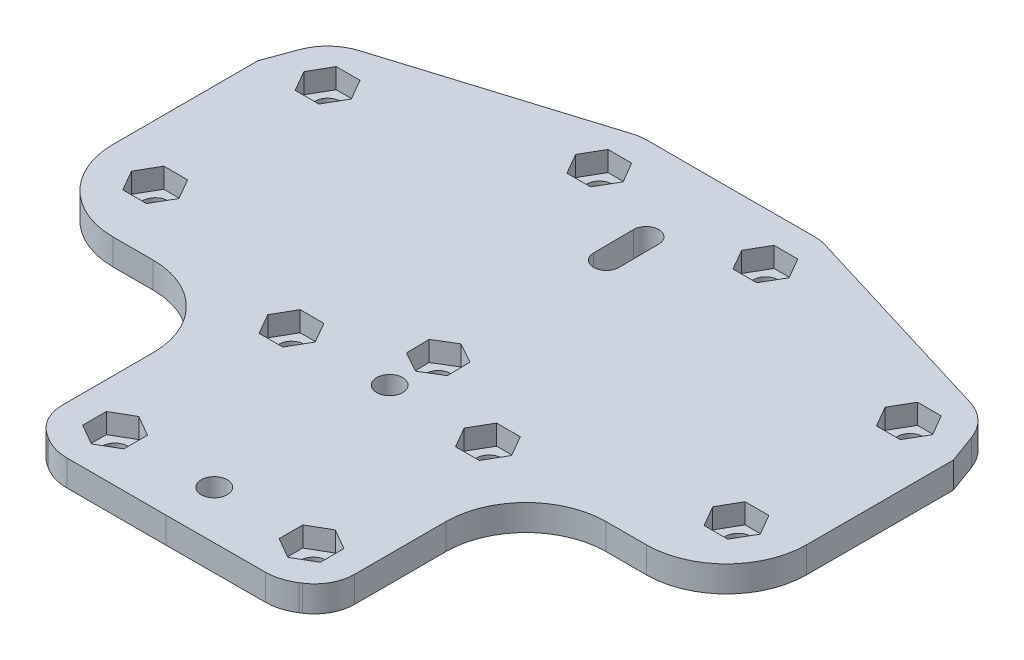
from build123d import *

# Parameters (mm, degrees)
SKETCH2_R          = 3.15
SKETCH2_R_2        = 3.25
SKETCH2_R_3        = 3.1
MAINPLATE_DEPTH    = 6.5
PRESSFITNUTS_DEPTH = 5
CUT_EXTRUDE2_DEPTH = 6.5
FILLET2_R          = 10


with BuildPart() as part:
    # Sketch2 → MainPlate (new body)
    with BuildSketch(Plane(origin=(0, 0, 0), x_dir=(1, 0, 0), z_dir=(0, 1, 0))):
        with BuildLine():
            Line((24.899900609, -92.429929219), (0.2, -92.5))
            Line((0.2, -92.5), (-24.5, -92.5))
            ThreePointArc((-24.5, -92.5), (-27.871368271, -92.016678166), (-30.971160559, -90.605645997))
            Line((-30.971160559, -90.605645997), (-99.683475736, -46.605645997))
            ThreePointArc((-99.683475736, -46.605645997), (-104.578950448, -40.347025165), (-104.490786491, -32.401697323))
            Line((-104.490786491, -32.401697323), (-83.778471314, 24.598302677))
            ThreePointArc((-83.778471314, 24.598302677), (-80.773721892, 29.191692934), (-76.037940173, 31.966602781))
            Line((-76.037940173, 31.966602781), (-24.911380811, 47.741345462))
            ThreePointArc((-24.911380811, 47.741345462), (-22.845839779, 48.308813352), (-20.712315177, 48.5))
            Line((-20.712315177, 48.5), (0, 48.5))
            Line((0, 48.5), (20.712231832, 48.558758223))
            ThreePointArc((20.712231832, 48.558758223), (22.846290221, 48.373624884), (24.913432777, 47.812018957))
            Line((24.913432777, 47.812018957), (76.084537362, 32.182379345))
            ThreePointArc((76.084537362, 32.182379345), (80.828172093, 29.420915478), (83.845940292, 24.836067799))
            Line((83.845940292, 24.836067799), (104.719873926, -32.104944614))
            ThreePointArc((104.719873926, -32.104944614), (104.830577421, -40.049990373), (99.952877324, -46.322473865))
            Line((99.952877324, -46.322473865), (31.365661085, -90.517224974))
            ThreePointArc((31.365661085, -90.517224974), (28.26988419, -91.937045184), (24.899900609, -92.429929219))
        make_face()
        with Locations(Location((-72.5, 20.5, 0), (0, 0, 90))):
            Circle(SKETCH2_R, mode=Mode.SUBTRACT)
        with Locations(Location((-20.712315177, 36.5, 0), (0, 0, 90))):
            Circle(SKETCH2_R, mode=Mode.SUBTRACT)
        with Locations(Location((-93.212315177, -36.5, 0), (0, 0, 90))):
            Circle(SKETCH2_R, mode=Mode.SUBTRACT)
        with Locations(Location((-58.856157589, -58.5, 0), (0, 0, 90))):
            Circle(SKETCH2_R, mode=Mode.SUBTRACT)
        with Locations(Location((-24.5, -80.5, 0), (0, 0, 90))):
            Circle(SKETCH2_R, mode=Mode.SUBTRACT)
        with Locations(Location((-24.5, -36.5, 0), (0, 0, 90))):
            Circle(SKETCH2_R, mode=Mode.SUBTRACT)
        with Locations(Location((-72.5, -22.5, 0), (0, 0, 90))):
            Circle(SKETCH2_R, mode=Mode.SUBTRACT)
        with Locations(Location((24.74103568, -36.430154559, 0), (0, 0, 90))):
            Circle(SKETCH2_R, mode=Mode.SUBTRACT)
        with Locations(Location((24.865858124, -80.429977506, 0), (0, 0, 90))):
            Circle(SKETCH2_R, mode=Mode.SUBTRACT)
        with Locations(Location((59.159466244, -58.332601952, 0), (0, 0, 90))):
            Circle(SKETCH2_R, mode=Mode.SUBTRACT)
        with Locations(Location((93.453074364, -36.235226398, 0), (0, 0, 90))):
            Circle(SKETCH2_R, mode=Mode.SUBTRACT)
        with Locations(Location((72.701126299, -22.294040956, 0), (0, 0, 90))):
            Circle(SKETCH2_R, mode=Mode.SUBTRACT)
        with Locations(Location((72.579140729, 20.705786015, 0), (0, 0, 90))):
            Circle(SKETCH2_R, mode=Mode.SUBTRACT)
        with Locations(Location((20.746274317, 36.55880651, 0), (0, 0, 90))):
            Circle(SKETCH2_R, mode=Mode.SUBTRACT)
        with Locations(Location((0, -36.5, 0), (0, 0, 90))):
            Circle(SKETCH2_R_2, mode=Mode.SUBTRACT)
        with Locations(Location((0.182929062, -80.464988753, 0), (0, 0, 90))):
            Circle(SKETCH2_R_2, mode=Mode.SUBTRACT)
        with Locations(Location((0.103546099, -24.5, 0), (0, 0, 90))):
            Circle(SKETCH2_R_3, mode=Mode.SUBTRACT)
        with BuildLine():
            Line((3.105906565, 27.527701056), (3.193849827, 17.527701056))
            ThreePointArc((3.193849827, 17.527701056), (0.071672688, 14.350121804), (-3.105906565, 17.472298944))
            Line((-3.105906565, 17.472298944), (-3.193849827, 27.472298944))
            ThreePointArc((-3.193849827, 27.472298944), (-0.071672688, 30.649878196), (3.105906565, 27.527701056))
        make_face(mode=Mode.SUBTRACT)
    extrude(amount=MAINPLATE_DEPTH)

    # Sketch8 → PressFitNuts (cut)
    with BuildSketch(Plane(origin=(0, 6.5, 0), x_dir=(1, 0, 0), z_dir=(0, 1, 0))):
        Polygon((-4.835460238, -27.48990798), (0.223379197, -30.272258948), (5.162385534, -27.282350968), (5.042552437, -21.51009202), (-0.016286998, -18.727741052), (-4.955293335, -21.717649032), align=None)
        Polygon((-18.582159741, -36.5), (-21.54107987, -31.375), (-27.45892013, -31.375), (-30.417840259, -36.5), (-27.45892013, -41.625), (-21.54107987, -41.625), align=None)
        Polygon((-66.582159741, -22.5), (-69.54107987, -17.375), (-75.45892013, -17.375), (-78.417840259, -22.5), (-75.45892013, -27.625), (-69.54107987, -27.625), align=None)
        Polygon((-66.582159741, 20.5), (-69.54107987, 25.625), (-75.45892013, 25.625), (-78.417840259, 20.5), (-75.45892013, 15.375), (-69.54107987, 15.375), align=None)
        Polygon((-87.294474918, -36.5), (-90.253395048, -31.375), (-96.171235307, -31.375), (-99.130155436, -36.5), (-96.171235307, -41.625), (-90.253395048, -41.625), align=None)
        Polygon((-52.938317329, -58.5), (-55.897237459, -53.375), (-61.815077718, -53.375), (-64.773997848, -58.5), (-61.815077718, -63.625), (-55.897237459, -63.625), align=None)
        Polygon((-24.5, -74.582159741), (-29.625, -77.54107987), (-29.625, -83.45892013), (-24.5, -86.417840259), (-19.375, -83.45892013), (-19.375, -77.54107987), align=None)
        Polygon((-14.794474918, 36.5), (-17.753395048, 41.625), (-23.671235307, 41.625), (-26.630155436, 36.5), (-23.671235307, 31.375), (-17.753395048, 31.375), align=None)
        Polygon((17.753395048, 31.375), (14.794474918, 36.5), (17.753395048, 41.625), (23.671235307, 41.625), (26.630155436, 36.5), (23.671235307, 31.375), align=None)
        Polygon((19.375, -77.54107987), (24.5, -74.582159741), (29.625, -77.54107987), (29.625, -83.45892013), (24.5, -86.417840259), (19.375, -83.45892013), align=None)
        Polygon((55.897237459, -63.625), (52.938317329, -58.5), (55.897237459, -53.375), (61.815077718, -53.375), (64.773997848, -58.5), (61.815077718, -63.625), align=None)
        Polygon((90.253395048, -41.625), (87.294474918, -36.5), (90.253395048, -31.375), (96.171235307, -31.375), (99.130155436, -36.5), (96.171235307, -41.625), align=None)
        Polygon((69.54107987, 15.375), (66.582159741, 20.5), (69.54107987, 25.625), (75.45892013, 25.625), (78.417840259, 20.5), (75.45892013, 15.375), align=None)
        Polygon((69.54107987, -27.625), (66.582159741, -22.5), (69.54107987, -17.375), (75.45892013, -17.375), (78.417840259, -22.5), (75.45892013, -27.625), align=None)
        Polygon((21.54107987, -41.625), (18.582159741, -36.5), (21.54107987, -31.375), (27.45892013, -31.375), (30.417840259, -36.5), (27.45892013, -41.625), align=None)
    extrude(amount=-PRESSFITNUTS_DEPTH, mode=Mode.SUBTRACT)

    # Sketch11 → Cut-Extrude2 (cut)
    with BuildSketch(Plane(origin=(0, 0, 0), x_dir=(1, 0, 0), z_dir=(0, 1, 0))):
        with BuildLine():
            Line((-111.9, 4.5), (-111.9, -116.15))
            Line((-111.9, -116.15), (-86.5, -116.15))
            Line((-86.5, -116.15), (-36.5, -116.15))
            Line((-36.5, -116.15), (-36.5, -59))
            ThreePointArc((-36.5, -59), (-42.357864376, -44.857864376), (-56.5, -39))
            Line((-56.5, -39), (-66.5, -39))
            ThreePointArc((-66.5, -39), (-80.642135624, -33.142135624), (-86.5, -19))
            Line((-86.5, -19), (-86.5, 4.5))
            Line((-86.5, 4.5), (-86.5, 44.576396133))
            Line((-86.5, 44.576396133), (-111.9, 44.576396133))
            Line((-111.9, 44.576396133), (-111.9, 4.5))
        make_face()
        with BuildLine():
            Line((86.5, 4.5), (86.5, 44.576396133))
            Line((86.5, 44.576396133), (111.9, 44.576396133))
            Line((111.9, 44.576396133), (111.9, 4.5))
            Line((111.9, 4.5), (111.9, -116.15))
            Line((111.9, -116.15), (86.5, -116.15))
            Line((86.5, -116.15), (36.5, -116.15))
            Line((36.5, -116.15), (36.5, -59))
            ThreePointArc((36.5, -59), (42.357864376, -44.857864376), (56.5, -39))
            Line((56.5, -39), (66.5, -39))
            ThreePointArc((66.5, -39), (80.642135624, -33.142135624), (86.5, -19))
            Line((86.5, -19), (86.5, 4.5))
        make_face()
    extrude(amount=CUT_EXTRUDE2_DEPTH, mode=Mode.SUBTRACT)

    # Fillet2
    fillet2_edges = [part.edges().sort_by_distance(p)[0] for p in [
        (36.5, 3.25, 87.208870401),
        (-36.5, 3.25, 87.065248111),
    ]]
    fillet(fillet2_edges, radius=FILLET2_R)


solid = part.part
